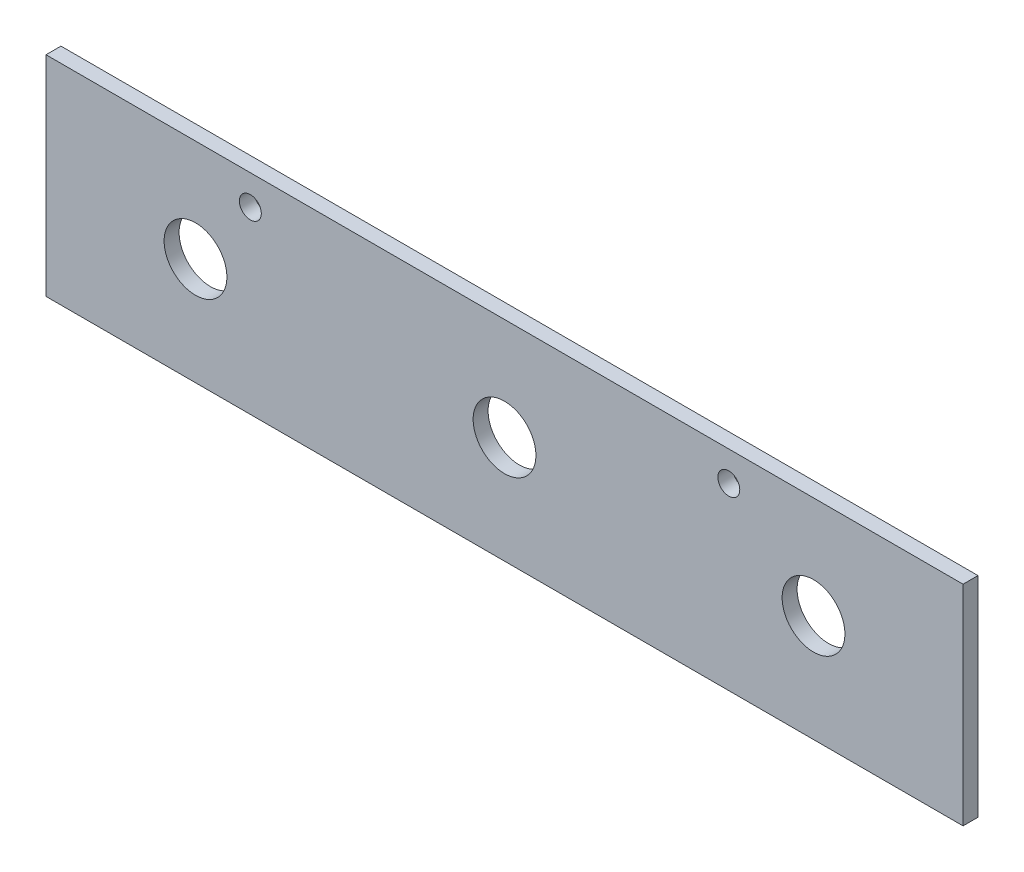
from build123d import *

# Parameters (mm, degrees)
THREE_BOSS_BORES_AND_BLANK_GEARBOX_F_2_W       = 184
THREE_BOSS_BORES_AND_BLANK_GEARBOX_F_2_H       = 42
THREE_BOSS_BORES_AND_BLANK_GEARBOX_F_2_R       = 6.3
THREE_BOSS_BORES_AND_BLANK_GEARBOX_F_2_R_2     = 2.2
THREE_BOSS_BORES_AND_BLANK_GEARBOX_FIXIN_DEPTH = 3


with BuildPart() as part:
    # Three boss bores and blank gearbox f 2 → Three boss bores and blank gearbox fixin (new body)
    with BuildSketch(Plane.XY):
        with Locations((0, 28)):
            Rectangle(THREE_BOSS_BORES_AND_BLANK_GEARBOX_F_2_W, THREE_BOSS_BORES_AND_BLANK_GEARBOX_F_2_H)
        with Locations((-62, 28.5)):
            Circle(THREE_BOSS_BORES_AND_BLANK_GEARBOX_F_2_R, mode=Mode.SUBTRACT)
        with Locations((0, 28.5)):
            Circle(THREE_BOSS_BORES_AND_BLANK_GEARBOX_F_2_R, mode=Mode.SUBTRACT)
        with Locations((62, 28.5)):
            Circle(THREE_BOSS_BORES_AND_BLANK_GEARBOX_F_2_R, mode=Mode.SUBTRACT)
        with Locations((-51, 43)):
            Circle(THREE_BOSS_BORES_AND_BLANK_GEARBOX_F_2_R_2, mode=Mode.SUBTRACT)
        with Locations((45, 43)):
            Circle(THREE_BOSS_BORES_AND_BLANK_GEARBOX_F_2_R_2, mode=Mode.SUBTRACT)
    extrude(amount=THREE_BOSS_BORES_AND_BLANK_GEARBOX_FIXIN_DEPTH)


solid = part.part
